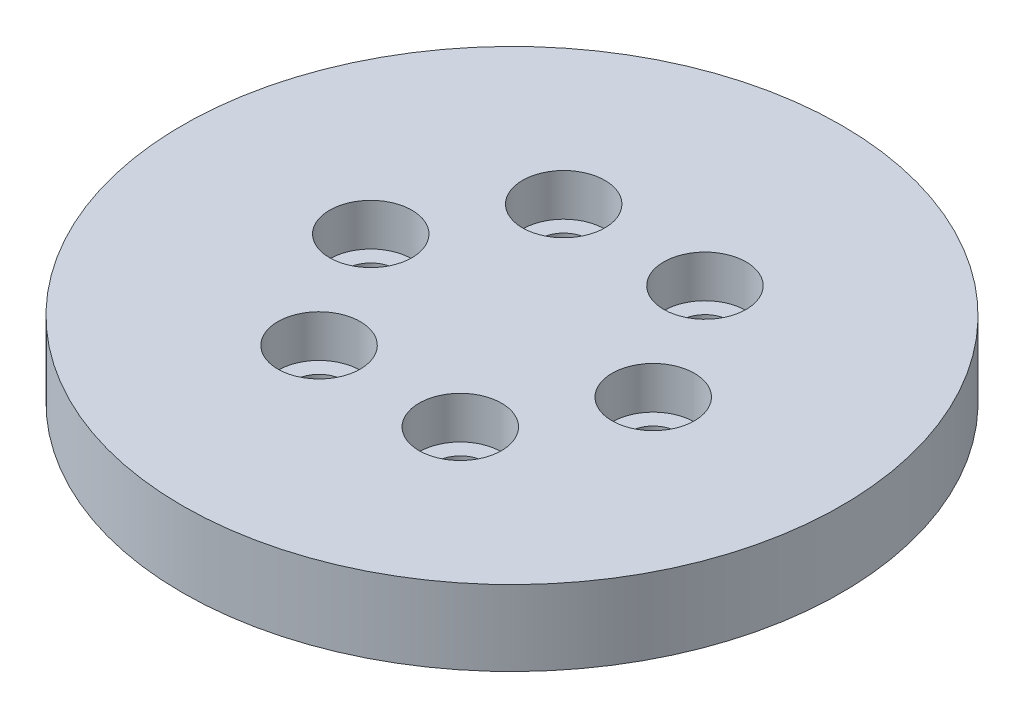
from build123d import *

# Parameters (mm, degrees)
SKETCH1_R                                      = 22.225
BOSS_EXTRUDE1_DEPTH                            = 5.08
CBORE_FOR_4_SOCKET_HEAD_CAP_SCREW1_D           = 3.2639
CBORE_FOR_4_SOCKET_HEAD_CAP_SCREW1_CBORE_D     = 5.55752
CBORE_FOR_4_SOCKET_HEAD_CAP_SCREW1_CBORE_DEPTH = 2.8448


with BuildPart() as part:
    # Sketch1 → Boss-Extrude1 (new body)
    with BuildSketch(Plane(origin=(0, 0, 0), x_dir=(1, 0, 0), z_dir=(0, 1, 0))):
        with Locations(Location((0, 0, 0), (0, 0, 270))):
            Circle(SKETCH1_R)
    extrude(amount=BOSS_EXTRUDE1_DEPTH)

    # CBORE for #4 Socket Head Cap Screw1 (through all)
    with Locations(Plane(origin=(0, 5.08, 0), x_dir=(1, 0, 0), z_dir=(0, 1, 0))):
        with Locations((-9.525, 0), (-4.7625, 8.248891971), (4.7625, 8.248891971), (9.525, 0), (4.7625, -8.248891971), (-4.7625, -8.248891971)):
            CounterBoreHole(CBORE_FOR_4_SOCKET_HEAD_CAP_SCREW1_D / 2, CBORE_FOR_4_SOCKET_HEAD_CAP_SCREW1_CBORE_D / 2, CBORE_FOR_4_SOCKET_HEAD_CAP_SCREW1_CBORE_DEPTH)


solid = part.part
